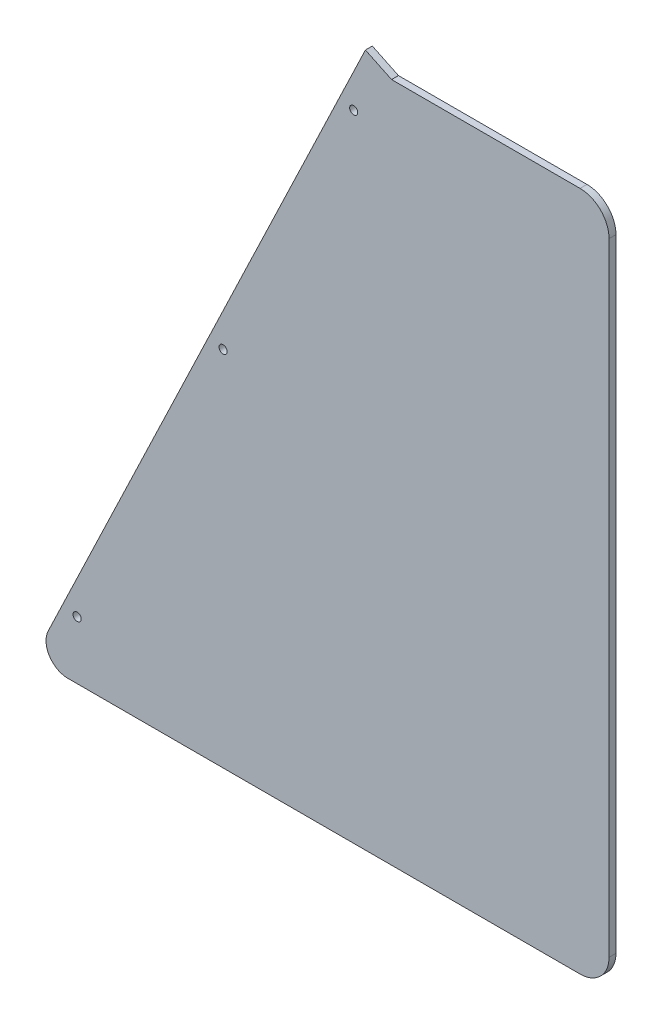
from build123d import *

# Parameters (mm, degrees)
SKETCH1_R           = 2.8
BOSS_EXTRUDE1_DEPTH = 4.7625


with BuildPart() as part:
    # Sketch1 → Boss-Extrude1 (new body)
    with BuildSketch(Plane.XY):
        with BuildLine():
            Line((103.944676345, 0), (-249.362453306, 0))
            ThreePointArc((-249.362453306, 0), (-262.056114412, 7.008068585), (-262.888702501, 21.483870968))
            Line((-262.888702501, 21.483870968), (-44.090322581, 477.927471542))
            Line((-44.090322581, 477.927471542), (-26.055323655, 469.282310251))
            Line((-26.055323655, 469.282310251), (103.944676345, 469.282310251))
            ThreePointArc((103.944676345, 469.282310251), (118.086811969, 463.424445875), (123.944676345, 449.282310251))
            Line((123.944676345, 449.282310251), (123.944676345, 20))
            ThreePointArc((123.944676345, 20), (118.086811969, 5.857864376), (103.944676345, 0))
        make_face()
        with Locations((-52.174961355, 437.927471542)):
            Circle(SKETCH1_R, mode=Mode.SUBTRACT)
        with Locations((-142.258875916, 250)):
            Circle(SKETCH1_R, mode=Mode.SUBTRACT)
        with Locations((-242.923360477, 40)):
            Circle(SKETCH1_R, mode=Mode.SUBTRACT)
    extrude(amount=-BOSS_EXTRUDE1_DEPTH)


solid = part.part
